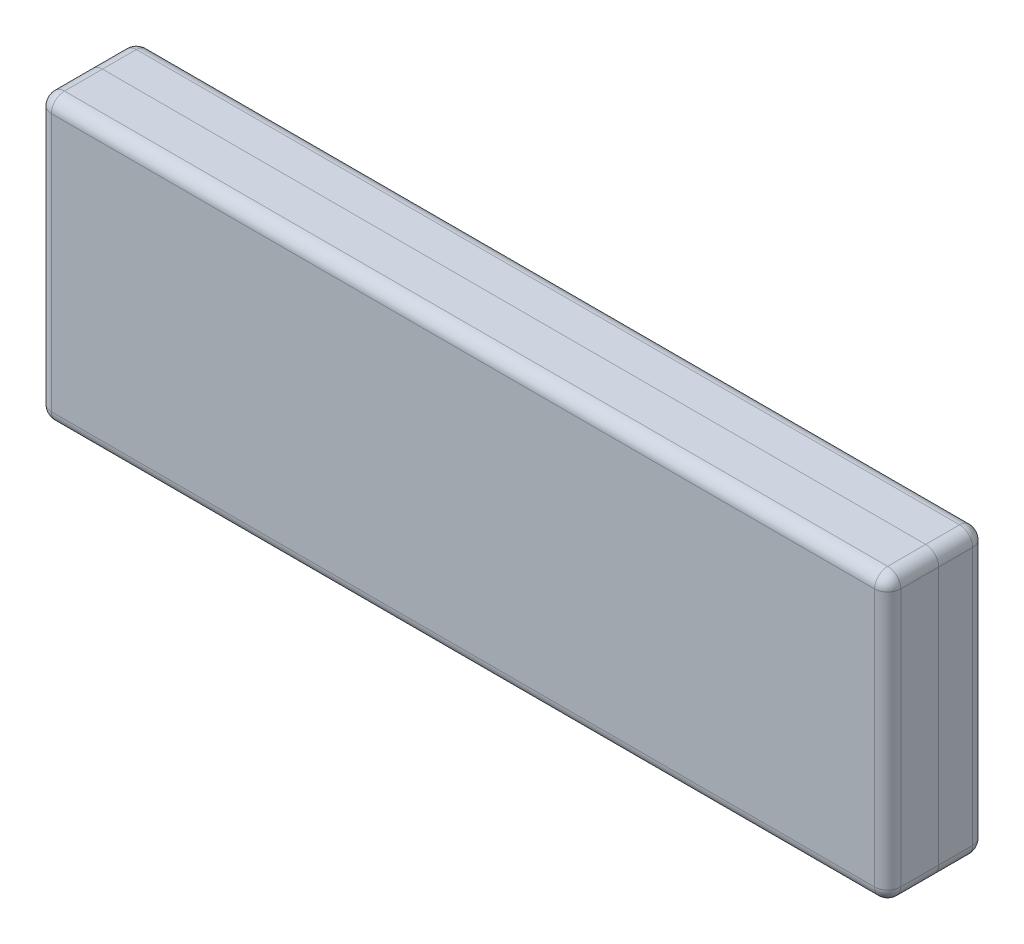
from build123d import *

# Parameters (mm, degrees)
SKETCH1_W              = 260
SKETCH1_H              = 87
BOSS_EXTRUDE1_DEPTH    = 30
CUT_EXTRUDE1_START     = -3
SKETCH7_R              = 12.25
CUT_EXTRUDE1_DEPTH     = 13
CUT_EXTRUDE2_START     = -68
SKETCH9_R              = 12.25
CUT_EXTRUDE2_DEPTH     = 65
FILLET1_R              = 4
SPLIT1_SURFACE_1_BACK  = 276.806
SPLIT1_SURFACE_1_DEPTH = 553.612
SPLIT1_SURFACE_2_BACK  = 276.806
SPLIT1_SURFACE_2_DEPTH = 553.612


with BuildPart() as part:
    # Sketch1 → Boss-Extrude1 (new body)
    with BuildSketch(Plane.XY):
        Rectangle(SKETCH1_W, SKETCH1_H)
    extrude(amount=BOSS_EXTRUDE1_DEPTH)

    # Sketch7 → Cut-Extrude1 (cut)
    with BuildSketch(Plane.XZ.offset(43.5).offset(CUT_EXTRUDE1_START)):
        with Locations(Location((-114.25, 15, 0), (0, 0, 270))):
            Circle(SKETCH7_R)
        with Locations(Location((-88.85, 15, 0), (0, 0, 270))):
            Circle(SKETCH7_R)
        with Locations(Location((-63.45, 15, 0), (0, 0, 270))):
            Circle(SKETCH7_R)
        with Locations(Location((-38.05, 15, 0), (0, 0, 270))):
            Circle(SKETCH7_R)
        with Locations(Location((-12.65, 15, 0), (0, 0, 270))):
            Circle(SKETCH7_R)
        with Locations(Location((12.75, 15, 0), (0, 0, 270))):
            Circle(SKETCH7_R)
        with Locations(Location((38.15, 15, 0), (0, 0, 270))):
            Circle(SKETCH7_R)
        with Locations(Location((63.55, 15, 0), (0, 0, 270))):
            Circle(SKETCH7_R)
        with Locations(Location((88.95, 15, 0), (0, 0, 270))):
            Circle(SKETCH7_R)
        with Locations(Location((114.35, 15, 0), (0, 0, 270))):
            Circle(SKETCH7_R)
    extrude(amount=-CUT_EXTRUDE1_DEPTH, mode=Mode.SUBTRACT)

    # Sketch9 → Cut-Extrude2 (cut)
    with BuildSketch(Plane(origin=(0, 43.5, 0), x_dir=(1, 0, 0), z_dir=(0, 1, 0)).offset(CUT_EXTRUDE2_START)):
        with Locations(Location((-114.25, -15, 0), (0, 0, 90))):
            Circle(SKETCH9_R)
        with Locations(Location((-88.85, -15, 0), (0, 0, 90))):
            Circle(SKETCH9_R)
        with Locations(Location((-63.45, -15, 0), (0, 0, 90))):
            Circle(SKETCH9_R)
        with Locations(Location((-38.05, -15, 0), (0, 0, 90))):
            Circle(SKETCH9_R)
        with Locations(Location((-12.65, -15, 0), (0, 0, 90))):
            Circle(SKETCH9_R)
        with Locations(Location((12.75, -15, 0), (0, 0, 90))):
            Circle(SKETCH9_R)
        with Locations(Location((38.15, -15, 0), (0, 0, 90))):
            Circle(SKETCH9_R)
        with Locations(Location((63.55, -15, 0), (0, 0, 90))):
            Circle(SKETCH9_R)
        with Locations(Location((88.95, -15, 0), (0, 0, 90))):
            Circle(SKETCH9_R)
        with Locations(Location((114.35, -15, 0), (0, 0, 90))):
            Circle(SKETCH9_R)
    extrude(amount=CUT_EXTRUDE2_DEPTH, mode=Mode.SUBTRACT)

    # Fillet1
    fillet1_edges = [part.edges().sort_by_distance(p)[0] for p in [
        (-130, 0, 30),
        (0, -43.5, 30),
        (130, 0, 30),
        (0, -43.5, 0),
        (-130, 0, 0),
        (0, 43.5, 0),
        (130, 0, 0),
        (0, 43.5, 30),
        (130, -43.5, 15),
        (-130, -43.5, 15),
        (-130, 43.5, 15),
        (130, 43.5, 15),
    ]]
    fillet(fillet1_edges, radius=FILLET1_R)


with BuildPart() as body_2:
    # Split1: the piece behind the surface
    add(part.part)
    # Split1 surface: a surface, the sketch's curves swept straight by 553.612 mm
    with BuildLine(Plane.XZ.offset(43.5).offset(-SPLIT1_SURFACE_1_BACK), mode=Mode.PRIVATE) as split1_surface_1_path:
        Line((-145.946002459, 14.378071012), (167.091588043, 14.378071012))
    split1_surface_1 = Shell.extrude(split1_surface_1_path.wire(), (0 * SPLIT1_SURFACE_1_DEPTH, -1 * SPLIT1_SURFACE_1_DEPTH, 0 * SPLIT1_SURFACE_1_DEPTH))
    split(bisect_by=split1_surface_1, keep=Keep.BOTTOM)


with BuildPart() as part_1:
    add(part.part)

    # Split1: split by a surface, the side it looks to stays
    # Split1 surface: a surface, the sketch's curves swept straight by 553.612 mm
    with BuildLine(Plane.XZ.offset(43.5).offset(-SPLIT1_SURFACE_2_BACK), mode=Mode.PRIVATE) as split1_surface_2_path:
        Line((-145.946002459, 14.378071012), (167.091588043, 14.378071012))
    split1_surface_2 = Shell.extrude(split1_surface_2_path.wire(), (0 * SPLIT1_SURFACE_2_DEPTH, -1 * SPLIT1_SURFACE_2_DEPTH, 0 * SPLIT1_SURFACE_2_DEPTH))
    split(bisect_by=split1_surface_2, keep=Keep.TOP)


solid = Compound([body_2.part, part_1.part])
